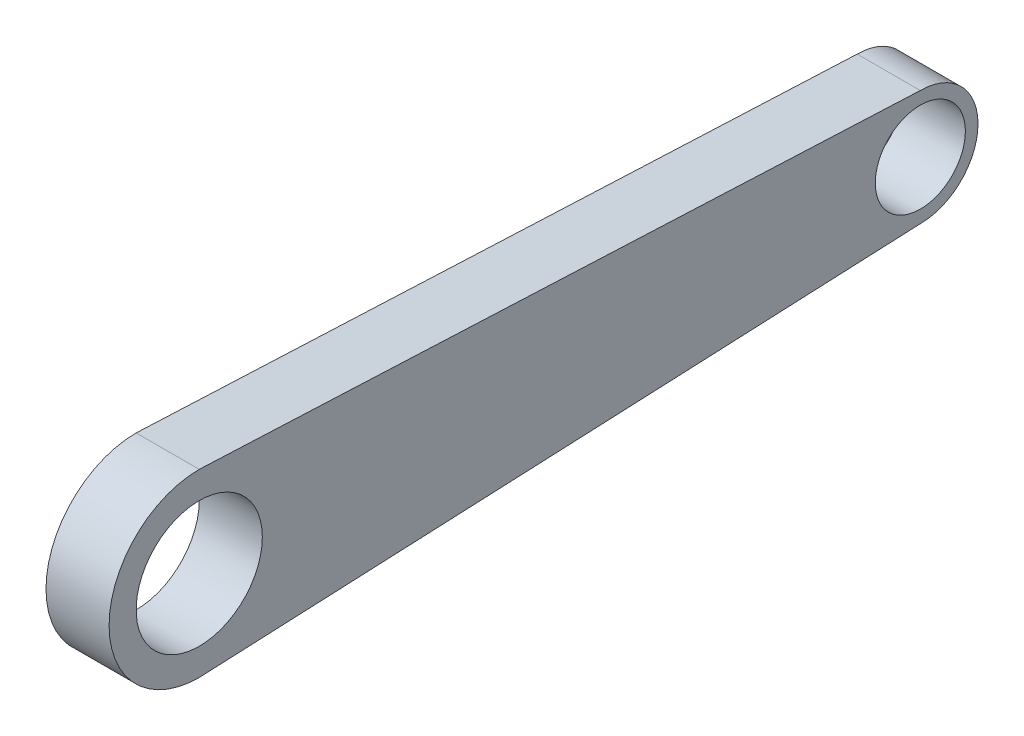
from build123d import *

# Parameters (mm, degrees)
SKETCH_3_R      = 3.5
SKETCH_3_R_2    = 2.5
EXTRUDE_2_DEPTH = 3.5


with BuildPart() as part:
    # 草图3 → 凸台-拉伸2 (new body)
    with BuildSketch(Plane(origin=(0, 0, 0), x_dir=(0, 0, -1), z_dir=(1, 0, 0))):
        with BuildLine():
            Line((0.449090592, 4.979790923), (0, 5))
            ThreePointArc((0, 5), (-5, 0), (0, -5))
            Line((0, -5), (0.449090592, -4.979790923))
            Line((0.449090592, -4.979790923), (40, -3.2))
            ThreePointArc((40, -3.2), (43.2, 0), (40, 3.2))
            Line((40, 3.2), (0.449090592, 4.979790923))
        make_face()
        Circle(SKETCH_3_R, mode=Mode.SUBTRACT)
        with Locations((40, 0)):
            Circle(SKETCH_3_R_2, mode=Mode.SUBTRACT)
    extrude(amount=EXTRUDE_2_DEPTH)


solid = part.part
